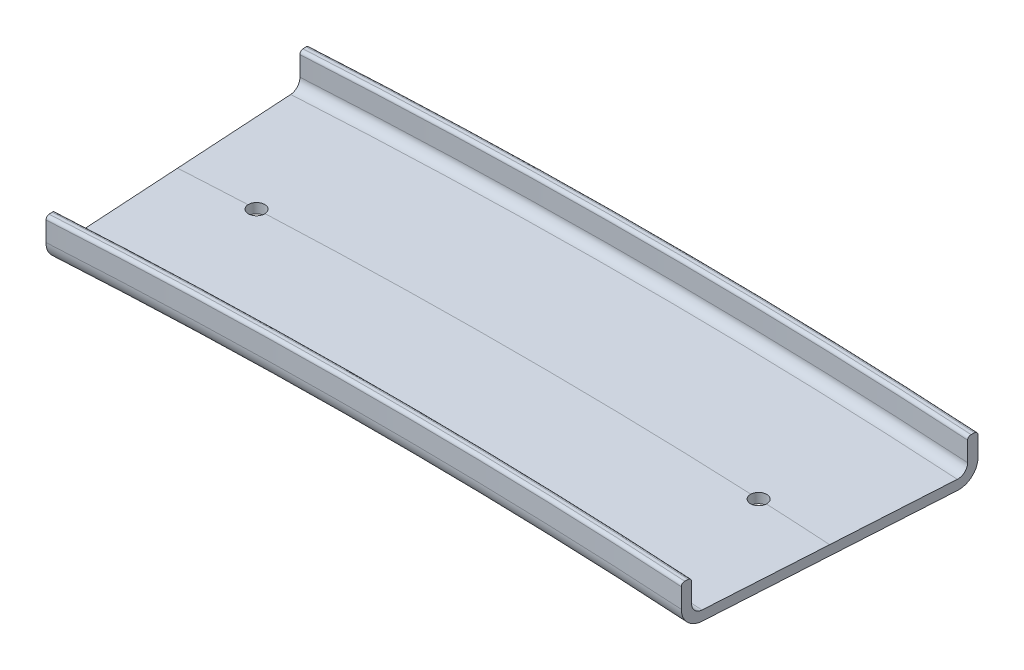
from build123d import *

# Parameters (mm, degrees)
RETAINING_SCREW_HOLES_DEPTH      = 113.83205248
RETAINING_SCREW_HOLES_DEPTH_BACK = 113.83205248
SKETCH3_R                        = 2.5


with BuildPart() as part:
    # Ceiling structural member cradle: sweep along a path in Sketch2
    with BuildLine(Plane(origin=(0, 0, 0), x_dir=(1, 0, 0), z_dir=(0, 1, 0))) as ceiling_structural_member_cradle_path:
        ThreePointArc((-100, -3), (0, 0), (100, -3))
    # Sketch1 → Ceiling structural member cradle (sweep)
    with BuildSketch(Plane(origin=(0, 0, 0), x_dir=(0, 0, -1), z_dir=(1, 0, 0))):
        with BuildLine():
            Line((0, 0), (-37, 0))
            ThreePointArc((-37, 0), (-39.121320344, 0.878679656), (-40, 3))
            Line((-40, 3), (-40, 9))
            ThreePointArc((-40, 9), (-40.292893219, 9.707106781), (-41, 10))
            Line((-41, 10), (-42, 10))
            ThreePointArc((-42, 10), (-42.707106781, 9.707106781), (-43, 9))
            Line((-43, 9), (-43, 3))
            ThreePointArc((-43, 3), (-41.242640687, -1.242640687), (-37, -3))
            Line((-37, -3), (37, -3))
            ThreePointArc((37, -3), (41.242640687, -1.242640687), (43, 3))
            Line((43, 3), (43, 9))
            ThreePointArc((43, 9), (42.707106781, 9.707106781), (42, 10))
            Line((42, 10), (41, 10))
            ThreePointArc((41, 10), (40.292893219, 9.707106781), (40, 9))
            Line((40, 9), (40, 3))
            ThreePointArc((40, 3), (39.121320344, 0.878679656), (37, 0))
            Line((37, 0), (0, 0))
        make_face()
    sweep(path=ceiling_structural_member_cradle_path.line)

    # Sketch3 → Retaining screw holes (cut, two sides: drawn at the far end of the back side and taken through both)
    with BuildSketch(Plane(origin=(0, 0, 0), x_dir=(1, 0, 0), z_dir=(0, 1, 0)).offset(-RETAINING_SCREW_HOLES_DEPTH_BACK)):
        with Locations(Location((-77, -1.778048193, 0), (0, 0, 270))):
            Circle(SKETCH3_R)
        with Locations(Location((77, -1.778048193, 0), (0, 0, 270))):
            Circle(SKETCH3_R)
    extrude(amount=RETAINING_SCREW_HOLES_DEPTH + RETAINING_SCREW_HOLES_DEPTH_BACK, mode=Mode.SUBTRACT)


solid = part.part
